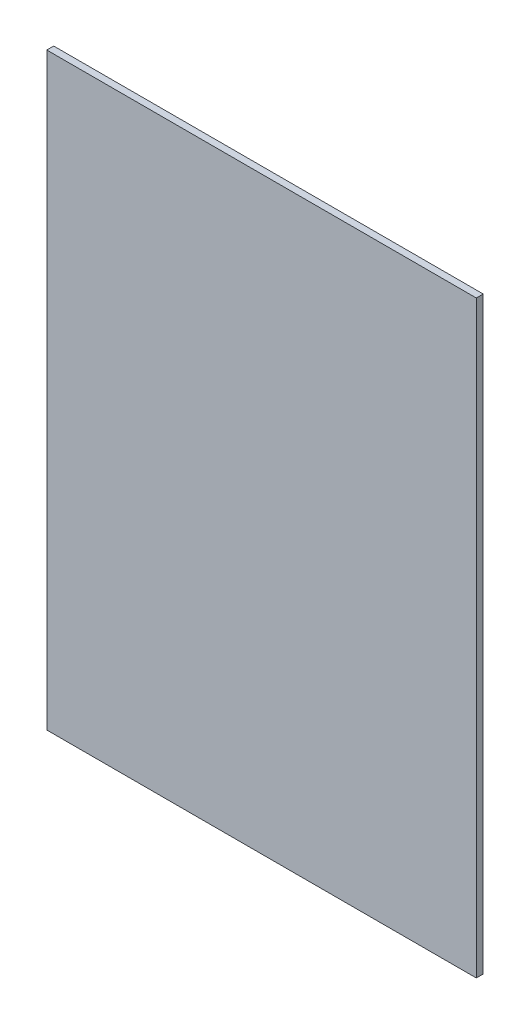
from build123d import *

# Parameters (mm, degrees)
SKETCH1_W           = 310
SKETCH1_H           = 425
BOSS_EXTRUDE1_DEPTH = 5


with BuildPart() as part:
    # Sketch1 → Boss-Extrude1 (new body)
    with BuildSketch(Plane.XY):
        Rectangle(SKETCH1_W, SKETCH1_H)
    extrude(amount=BOSS_EXTRUDE1_DEPTH)


solid = part.part
